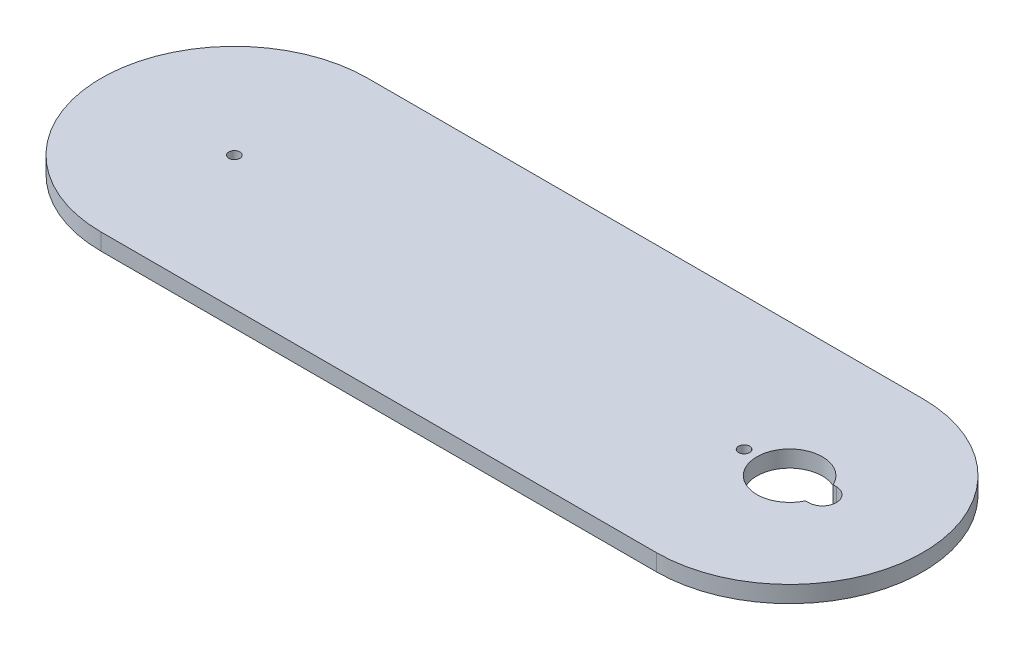
from build123d import *

# Parameters (mm, degrees)
BOSS_EXTRUDE1_DEPTH = 3
SKETCH2_R           = 1
CUT_EXTRUDE1_DEPTH  = 3
CUT_EXTRUDE2_DEPTH  = 3
SKETCH4_R           = 1
CUT_EXTRUDE3_DEPTH  = 3


with BuildPart() as part:
    # Sketch1 → Boss-Extrude1 (new body)
    with BuildSketch(Plane(origin=(0, 0, 0), x_dir=(1, 0, 0), z_dir=(0, 1, 0))):
        with BuildLine():
            Line((0, 24), (100, 24))
            ThreePointArc((100, 24), (124, 0), (100, -24))
            Line((100, -24), (0, -24))
            ThreePointArc((0, -24), (-24, 0), (0, 24))
        make_face()
    extrude(amount=BOSS_EXTRUDE1_DEPTH)

    # Sketch2 → Cut-Extrude1 (cut)
    with BuildSketch(Plane(origin=(0, 3, 0), x_dir=(1, 0, 0), z_dir=(0, 1, 0))):
        with Locations(Location((0, 0, 0), (0, 0, 270))):
            Circle(SKETCH2_R)
    extrude(amount=-CUT_EXTRUDE1_DEPTH, mode=Mode.SUBTRACT)

    # Sketch3 → Cut-Extrude2 (cut)
    with BuildSketch(Plane(origin=(0, 3, 0), x_dir=(1, 0, 0), z_dir=(0, 1, 0))):
        with BuildLine():
            Line((105.344155686, 2.5), (105.904155686, 2.5))
            ThreePointArc((105.904155686, 2.5), (108.404155686, 0), (105.904155686, -2.5))
            Line((105.904155686, -2.5), (105.344155686, -2.5))
            ThreePointArc((105.344155686, -2.5), (94.1, 0), (105.344155686, 2.5))
        make_face()
    extrude(amount=-CUT_EXTRUDE2_DEPTH, mode=Mode.SUBTRACT)

    # Sketch4 → Cut-Extrude3 (cut)
    with BuildSketch(Plane(origin=(0, 3, 0), x_dir=(1, 0, 0), z_dir=(0, 1, 0))):
        with Locations(Location((91.8, 0, 0), (0, 0, 270))):
            Circle(SKETCH4_R)
    extrude(amount=-CUT_EXTRUDE3_DEPTH, mode=Mode.SUBTRACT)


solid = part.part
